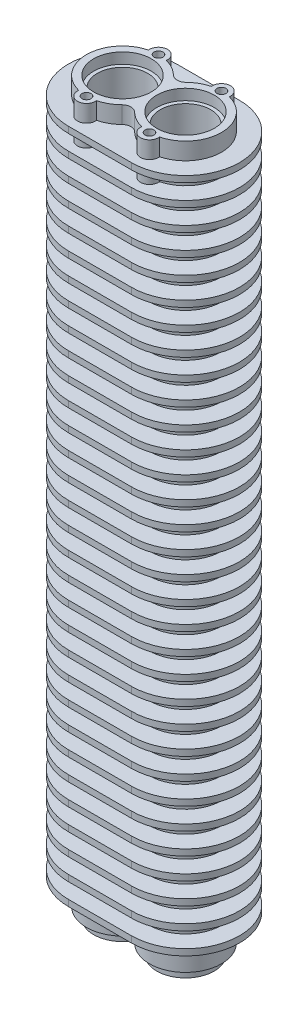
from build123d import *

# Parameters (mm, degrees)
SKETCH2_R             = 14
EXTRUDE1_DEPTH        = 400
EXTRUDE2_DEPTH        = 3.5
LPATTERN1_COUNT       = 32
LPATTERN1_PITCH       = 12
SKETCH4_R             = 14
CUT_EXTRUDE1_DEPTH    = 398.007871458
EXTRUDE3_START        = -21.5
SKETCH5_R             = 5
EXTRUDE3_DEPTH        = 21.5
M6_TAPPED_HOLE2_D     = 5
M6_TAPPED_HOLE2_DEPTH = 18
M6_TAPPED_HOLE2_TIP   = 1.502151548
M6_TAPPED_HOLE3_D     = 5
M6_TAPPED_HOLE3_DEPTH = 18
M6_TAPPED_HOLE3_TIP   = 1.502151548
M6_TAPPED_HOLE4_D     = 5
M6_TAPPED_HOLE4_DEPTH = 18
M6_TAPPED_HOLE4_TIP   = 1.502151548
M6_TAPPED_HOLE5_D     = 5
M6_TAPPED_HOLE5_DEPTH = 18
M6_TAPPED_HOLE5_TIP   = 1.502151548
SKETCH19_R            = 16
CUT_EXTRUDE2_DEPTH    = 6
SKETCH20_R            = 16
SKETCH20_R_2          = 14
EXTRUDE4_DEPTH        = 5.5


with BuildPart() as part:
    # Sketch2 → Extrude1 (new body)
    with BuildSketch(Plane(origin=(0, 0, 0), x_dir=(1, 0, 0), z_dir=(0, 1, 0))):
        with BuildLine():
            ThreePointArc((14, 14.282856857), (-20, 0), (14, -14.282856857))
            ThreePointArc((14, -14.282856857), (17.5, -12.853571071), (21, -14.282856857))
            ThreePointArc((21, -14.282856857), (55, 0), (21, 14.282856857))
            ThreePointArc((21, 14.282856857), (17.5, 12.853571071), (14, 14.282856857))
        make_face()
        with Locations(Location((0, 0, 0), (0, 0, 270))):
            Circle(SKETCH2_R, mode=Mode.SUBTRACT)
        with Locations(Location((35, 0, 0), (0, 0, 270))):
            Circle(SKETCH2_R, mode=Mode.SUBTRACT)
    extrude(amount=EXTRUDE1_DEPTH)

    # Sketch3 → Extrude2 (add)
    with BuildSketch(Plane.XZ.offset(-15)):
        with BuildLine():
            Line((0, 30), (35, 30))
            ThreePointArc((35, 30), (65, 0), (35, -30))
            Line((35, -30), (0, -30))
            ThreePointArc((0, -30), (-30, 0), (0, 30))
        make_face()
    extrude2 = extrude(amount=-EXTRUDE2_DEPTH)

    # LPattern1: Extrude2 ×32
    with Locations(*[(0, i * LPATTERN1_PITCH, 0) for i in range(1, LPATTERN1_COUNT)]):
        add(extrude2)

    # Sketch4 → Cut-Extrude1 (cut, through all)
    with BuildSketch(Plane(origin=(0, 390.5, 0), x_dir=(1, 0, 0), z_dir=(0, 1, 0))):
        with Locations(Location((0, 0, 0), (0, 0, 270))):
            Circle(SKETCH4_R)
        with Locations(Location((35, 0, 0), (0, 0, 270))):
            Circle(SKETCH4_R)
    extrude(amount=-CUT_EXTRUDE1_DEPTH, mode=Mode.SUBTRACT)

    # Sketch5 → Extrude3 (add)
    with BuildSketch(Plane(origin=(0, 400, 0), x_dir=(1, 0, 0), z_dir=(0, 1, 0)).offset(EXTRUDE3_START)):
        with Locations((0, 20)):
            Circle(SKETCH5_R)
        with Locations((35, 20)):
            Circle(SKETCH5_R)
        with Locations((35, -20)):
            Circle(SKETCH5_R)
        with Locations((0, -20)):
            Circle(SKETCH5_R)
    extrude(amount=EXTRUDE3_DEPTH)

    # M6 Tapped Hole2
    with Locations(Plane(origin=(0, 400, 0), x_dir=(-1, 0, 0), z_dir=(0, 1, 0))):
        with Locations((0, -20)):
            Hole(M6_TAPPED_HOLE2_D / 2, depth=M6_TAPPED_HOLE2_DEPTH)
            with Locations((0, 0, -(M6_TAPPED_HOLE2_DEPTH + M6_TAPPED_HOLE2_TIP / 2))):  # 118° drill point
                Cone(0, M6_TAPPED_HOLE2_D / 2, M6_TAPPED_HOLE2_TIP, mode=Mode.SUBTRACT)

    # M6 Tapped Hole3
    with Locations(Plane(origin=(0, 400, 0), x_dir=(-1, 0, 0), z_dir=(0, 1, 0))):
        with Locations((0, 20)):
            Hole(M6_TAPPED_HOLE3_D / 2, depth=M6_TAPPED_HOLE3_DEPTH)
            with Locations((0, 0, -(M6_TAPPED_HOLE3_DEPTH + M6_TAPPED_HOLE3_TIP / 2))):  # 118° drill point
                Cone(0, M6_TAPPED_HOLE3_D / 2, M6_TAPPED_HOLE3_TIP, mode=Mode.SUBTRACT)

    # M6 Tapped Hole4
    with Locations(Plane(origin=(0, 400, 0), x_dir=(-1, 0, 0), z_dir=(0, 1, 0))):
        with Locations((-35, 20)):
            Hole(M6_TAPPED_HOLE4_D / 2, depth=M6_TAPPED_HOLE4_DEPTH)
            with Locations((0, 0, -(M6_TAPPED_HOLE4_DEPTH + M6_TAPPED_HOLE4_TIP / 2))):  # 118° drill point
                Cone(0, M6_TAPPED_HOLE4_D / 2, M6_TAPPED_HOLE4_TIP, mode=Mode.SUBTRACT)

    # M6 Tapped Hole5
    with Locations(Plane(origin=(0, 400, 0), x_dir=(-1, 0, 0), z_dir=(0, 1, 0))):
        with Locations((-35, -20)):
            Hole(M6_TAPPED_HOLE5_D / 2, depth=M6_TAPPED_HOLE5_DEPTH)
            with Locations((0, 0, -(M6_TAPPED_HOLE5_DEPTH + M6_TAPPED_HOLE5_TIP / 2))):  # 118° drill point
                Cone(0, M6_TAPPED_HOLE5_D / 2, M6_TAPPED_HOLE5_TIP, mode=Mode.SUBTRACT)

    # Sketch19 → Cut-Extrude2 (cut)
    with BuildSketch(Plane(origin=(0, 400, 0), x_dir=(1, 0, 0), z_dir=(0, 1, 0))):
        with Locations(Location((0, 0, 0), (0, 0, 270))):
            Circle(SKETCH19_R)
        with Locations(Location((35, 0, 0), (0, 0, 270))):
            Circle(SKETCH19_R)
    extrude(amount=-CUT_EXTRUDE2_DEPTH, mode=Mode.SUBTRACT)

    # Sketch20 → Extrude4 (add)
    # profile 1 of 2: a face of its own
    with BuildSketch(Plane.XZ):
        with Locations(Location((0, 0, 0), (0, 0, 90))):
            Circle(SKETCH20_R)
        with Locations(Location((0, 0, 0), (0, 0, 270))):
            Circle(SKETCH20_R_2, mode=Mode.SUBTRACT)
    # profile 2 of 2: a face of its own
    with BuildSketch(Plane.XZ):
        with Locations(Location((35, 0, 0), (0, 0, 90))):
            Circle(SKETCH20_R)
        with Locations(Location((35, 0, 0), (0, 0, 270))):
            Circle(SKETCH20_R_2, mode=Mode.SUBTRACT)
    extrude(amount=EXTRUDE4_DEPTH)


solid = part.part
